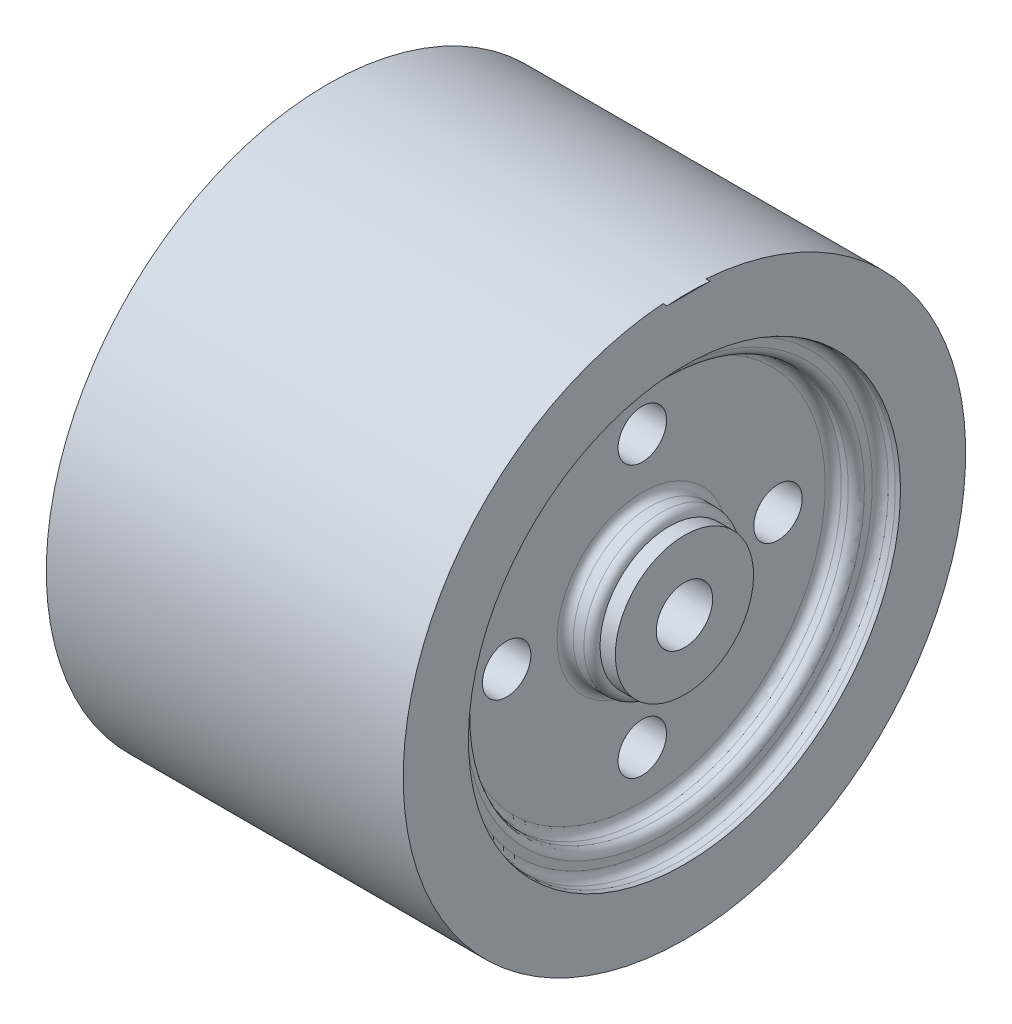
from build123d import *

# Parameters (mm, degrees)
SKETCH4_R                = 3.00725893
CUT_EXTRUDE2_DEPTH       = 67
BOSS_EXTRUDE1_DEPTH      = 4
BOSS_EXTRUDE1_DEPTH_BACK = 44
SKETCH5_R                = 8.579050849
SKETCH5_R_2              = 3.5
SKETCH6_W                = 27.472929146
SKETCH6_H                = 21.134737858
CUT_EXTRUDE3_DEPTH       = 2
SKETCH7_W                = 27.650670989
SKETCH7_H                = 23.658848769
CUT_EXTRUDE4_DEPTH       = 2
SKETCH8_W                = 105.734608076
SKETCH8_H                = 74.092114867
CUT_EXTRUDE5_DEPTH       = 0.5
SKETCH9_W                = 29.792624375
SKETCH9_H                = 24.437740909
CUT_EXTRUDE7_DEPTH       = 16.5


with BuildPart() as part:
    # Sketch1 → Revolve2 (revolve)
    with BuildSketch(Plane.XY):
        with BuildLine():
            Line((20, 30.585043499), (-20, 30.585043499))
            Line((-20, 30.585043499), (-20, 25.50599265))
            ThreePointArc((-20, 25.50599265), (-19.707106781, 24.798885869), (-19, 24.50599265))
            Line((-19, 24.50599265), (-17.668642291, 24.50599265))
            ThreePointArc((-17.668642291, 24.50599265), (-16.96153551, 24.213099431), (-16.668642291, 23.50599265))
            Line((-16.668642291, 23.50599265), (-16.668642291, 11.375231402))
            ThreePointArc((-16.668642291, 11.375231402), (-16.96153551, 10.668124621), (-17.668642291, 10.375231402))
            Line((-17.668642291, 10.375231402), (-18.534321146, 10.375231402))
            ThreePointArc((-18.534321146, 10.375231402), (-19.241427927, 10.082338183), (-19.534321146, 9.375231402))
            Line((-19.534321146, 9.375231402), (-19.534321146, 8.403173973))
            ThreePointArc((-19.534321146, 8.403173973), (-19.827214364, 7.696067192), (-20.534321146, 7.403173973))
            Line((-20.534321146, 7.403173973), (-21.4, 7.403173973))
            ThreePointArc((-21.4, 7.403173973), (-22.107106781, 7.110280754), (-22.4, 6.403173973))
            Line((-22.4, 6.403173973), (-22.4, -0.822369318))
            Line((-22.4, -0.822369318), (22.4, -0.822369318))
            Line((22.4, -0.822369318), (22.4, 6.403173973))
            ThreePointArc((22.4, 6.403173973), (22.107106781, 7.110280754), (21.4, 7.403173973))
            Line((21.4, 7.403173973), (20.534321146, 7.403173973))
            ThreePointArc((20.534321146, 7.403173973), (19.827214364, 7.696067192), (19.534321146, 8.403173973))
            Line((19.534321146, 8.403173973), (19.534321146, 9.375231402))
            ThreePointArc((19.534321146, 9.375231402), (19.241427927, 10.082338183), (18.534321146, 10.375231402))
            Line((18.534321146, 10.375231402), (17.668642291, 10.375231402))
            ThreePointArc((17.668642291, 10.375231402), (16.96153551, 10.668124621), (16.668642291, 11.375231402))
            Line((16.668642291, 11.375231402), (16.668642291, 23.50599265))
            ThreePointArc((16.668642291, 23.50599265), (16.96153551, 24.213099431), (17.668642291, 24.50599265))
            Line((17.668642291, 24.50599265), (19, 24.50599265))
            ThreePointArc((19, 24.50599265), (19.707106781, 24.798885869), (20, 25.50599265))
            Line((20, 25.50599265), (20, 30.585043499))
        make_face()
    revolve(axis=Axis((-45.34499362, 34.085043499, 0), (1, 0, 0)))

    # Sketch4 → Cut-Extrude2 (cut)
    with BuildSketch(Plane(origin=(16.668642291, 0, 0), x_dir=(0, 0, -1), z_dir=(1, 0, 0))):
        with Locations(Location((0, 50.924451375, 0), (0, 0, 90))):
            Circle(SKETCH4_R)
        with Locations(Location((16.839407875, 34.085043499, 0), (0, 0, 90))):
            Circle(SKETCH4_R)
        with Locations(Location((0, 17.245635624, 0), (0, 0, 90))):
            Circle(SKETCH4_R)
        with Locations(Location((-16.839407875, 34.085043499, 0), (0, 0, 90))):
            Circle(SKETCH4_R)
    extrude(amount=-CUT_EXTRUDE2_DEPTH, mode=Mode.SUBTRACT)

    # Sketch5 → Boss-Extrude1 (add, two sides: drawn at the far end of the back side and taken through both)
    with BuildSketch(Plane(origin=(20, 0, 0), x_dir=(0, 0, -1), z_dir=(1, 0, 0)).offset(-BOSS_EXTRUDE1_DEPTH_BACK)):
        with Locations(Location((0, 34.085043499, 0), (0, 0, 90))):
            Circle(SKETCH5_R)
        with Locations(Location((0, 34.085043499, 0), (0, 0, 90))):
            Circle(SKETCH5_R_2, mode=Mode.SUBTRACT)
    extrude(amount=BOSS_EXTRUDE1_DEPTH + BOSS_EXTRUDE1_DEPTH_BACK)

    # Sketch6 → Cut-Extrude3 (cut)
    with BuildSketch(Plane.ZY.offset(24)):
        with Locations((-1.435444058, 31.986358851)):
            Rectangle(SKETCH6_W, SKETCH6_H)
    extrude(amount=-CUT_EXTRUDE3_DEPTH, mode=Mode.SUBTRACT)

    # Sketch7 → Cut-Extrude4 (cut)
    with BuildSketch(Plane(origin=(24, 0, 0), x_dir=(0, 0, -1), z_dir=(1, 0, 0))):
        with Locations((-1.070976694, 34.279766534)):
            Rectangle(SKETCH7_W, SKETCH7_H)
    extrude(amount=-CUT_EXTRUDE4_DEPTH, mode=Mode.SUBTRACT)

    # Sketch8 → Cut-Extrude5 (cut)
    with BuildSketch(Plane(origin=(22.4, 0, 0), x_dir=(0, 0, -1), z_dir=(1, 0, 0))):
        with Locations((6.036414089, 31.845728596)):
            Rectangle(SKETCH8_W, SKETCH8_H)
    extrude(amount=-CUT_EXTRUDE5_DEPTH, mode=Mode.SUBTRACT)

    # Sketch9 → Cut-Extrude7 (cut)
    with BuildSketch(Plane.ZY.offset(22)):
        with Locations((2.044591869, 33.598235912)):
            Rectangle(SKETCH9_W, SKETCH9_H)
    extrude(amount=CUT_EXTRUDE7_DEPTH, mode=Mode.SUBTRACT)


solid = part.part
